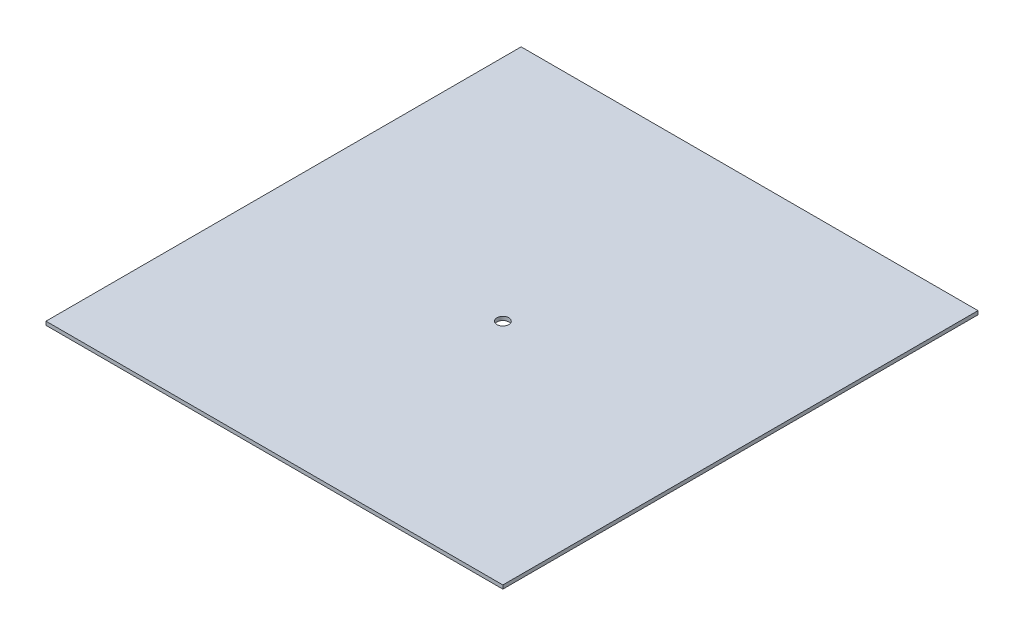
from build123d import *

# Parameters (mm, degrees)
SKETCH1_W               = 250
SKETCH1_H               = 260
BOSS_EXTRUDE1_DEPTH     = 2
THRMOCOUPLER_HOLE_D     = 6.5
THRMOCOUPLER_HOLE_DEPTH = 23
THRMOCOUPLER_HOLE_TIP   = 1.952797012


with BuildPart() as part:
    # Sketch1 → Boss-Extrude1 (new body)
    with BuildSketch(Plane(origin=(0, 0, 0), x_dir=(1, 0, 0), z_dir=(0, 1, 0))):
        with Locations((125, 130)):
            Rectangle(SKETCH1_W, SKETCH1_H)
    extrude(amount=BOSS_EXTRUDE1_DEPTH)

    # Thrmocoupler hole
    with Locations(Plane(origin=(0, 2, 0), x_dir=(-1, 0, 0), z_dir=(0, 1, 0))):
        with Locations((-125, -125)):
            Hole(THRMOCOUPLER_HOLE_D / 2, depth=THRMOCOUPLER_HOLE_DEPTH)
            with Locations((0, 0, -(THRMOCOUPLER_HOLE_DEPTH + THRMOCOUPLER_HOLE_TIP / 2))):  # 118° drill point
                Cone(0, THRMOCOUPLER_HOLE_D / 2, THRMOCOUPLER_HOLE_TIP, mode=Mode.SUBTRACT)


solid = part.part
